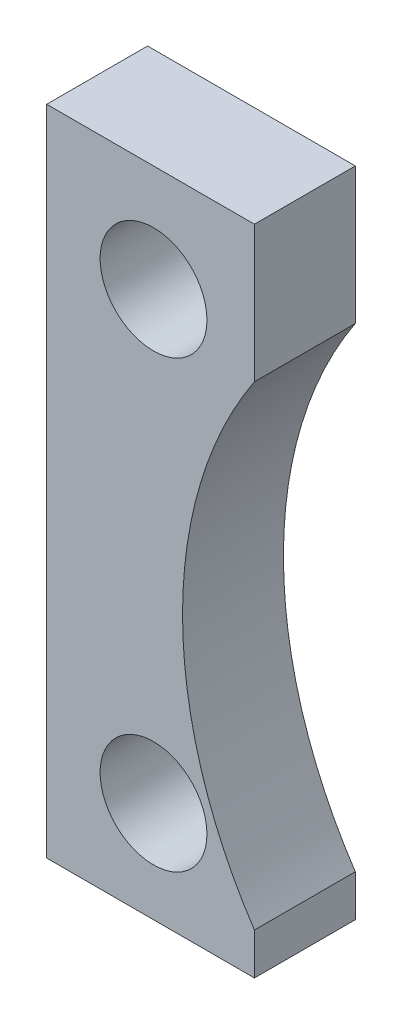
from build123d import *

# Parameters (mm, degrees)
BOSS_EXTRUDE1_DEPTH = 8.5
SKETCH2_R           = 9
CUT_EXTRUDE1_DEPTH  = 117.679046962


with BuildPart() as part:
    # Sketch1 → Boss-Extrude1 (new, symmetric)
    with BuildSketch(Plane.XY):
        with BuildLine():
            Line((0, 110), (35, 110))
            Line((35, 110), (35, 87))
            ThreePointArc((35, 87), (22.888974491, 47), (35, 7))
            Line((35, 7), (35, 0))
            Line((35, 0), (0, 0))
            Line((0, 0), (0, 110))
        make_face()
    extrude(amount=BOSS_EXTRUDE1_DEPTH, both=True)

    # Sketch2 → Cut-Extrude1 (cut, through all)
    with BuildSketch(Plane.XY.offset(8.5)):
        with Locations((18, 92)):
            Circle(SKETCH2_R)
        with Locations((18, 17)):
            Circle(SKETCH2_R)
    extrude(amount=-CUT_EXTRUDE1_DEPTH, mode=Mode.SUBTRACT)


solid = part.part
